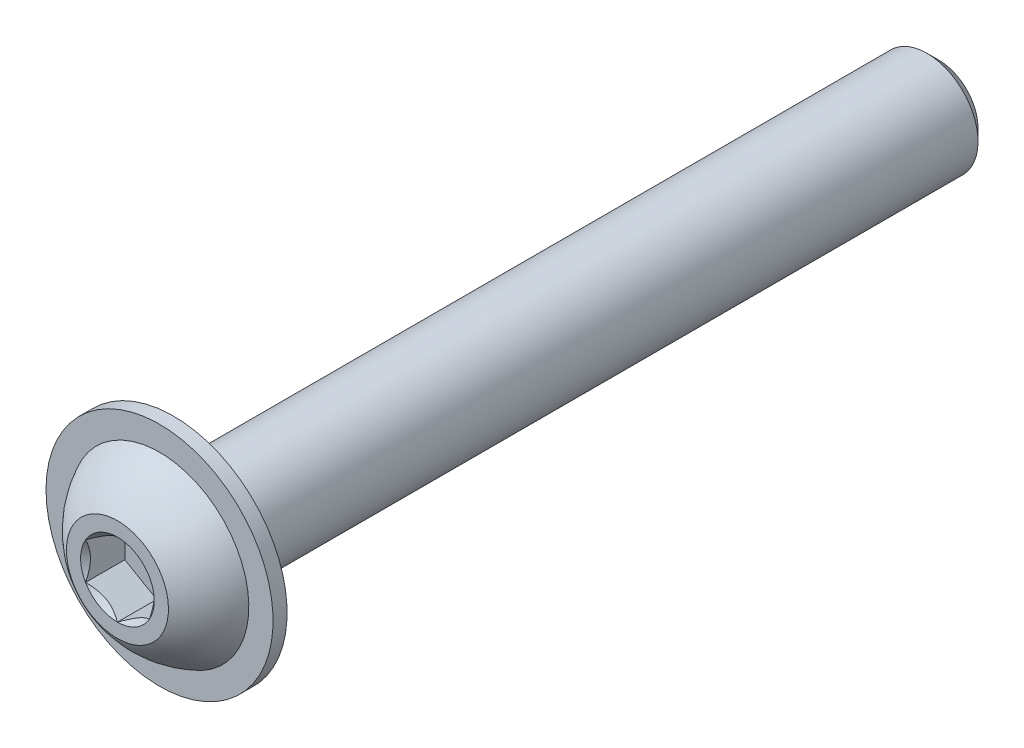
from build123d import *

# Parameters (mm, degrees)
SKETCH1_W           = 60
SKETCH1_H           = 4
CHAMFER1_SIZE       = 0.9375
SKETCH11_R          = 8.9
BOSS_EXTRUDE3_DEPTH = 1.1
CUT_EXTRUDE2_DEPTH  = 3.08


with BuildPart() as part:
    # Sketch1 → Revolve1 (revolve)
    with BuildSketch(Plane(origin=(0, 0, 0), x_dir=(0, 0, -1), z_dir=(1, 0, 0))):
        with Locations((34.4, 2)):
            Rectangle(SKETCH1_W, SKETCH1_H)
    revolve(axis=Axis((0, 0, -64.4), (0, 0, 1)))

    # Chamfer1
    chamfer1_edges = [part.edges().sort_by_distance(p)[0] for p in [
        (0, -4, -64.4),
    ]]
    chamfer(chamfer1_edges, length=CHAMFER1_SIZE)

    # Sketch7 → Revolve2 (revolve)
    with BuildSketch(Plane(origin=(0, 0, 0), x_dir=(0, 0, -1), z_dir=(1, 0, 0)), mode=Mode.PRIVATE) as revolve2_sk:
        with BuildLine():
            Line((3.3, 7), (4.4, 7))
            Line((4.4, 7), (4.4, 0))
            Line((4.4, 0), (0, 0))
            Line((0, 0), (0, 4))
            ThreePointArc((0, 4), (1.429846746, 5.74216858), (3.3, 7))
        make_face()
    revolve(revolve2_sk.sketch.rotate(Axis((0, 0, 0), (0, 0, -1)), 180), axis=Axis((0, 0, 0), (0, 0, -1)))

    # Sketch11 → Boss-Extrude3 (add)
    with BuildSketch(Plane(origin=(0, 0, -4.4), x_dir=(-1, 0, 0), z_dir=(0, 0, -1))):
        Circle(SKETCH11_R)
    extrude(amount=-BOSS_EXTRUDE3_DEPTH)

    # Sketch5 → Cut-Extrude2 (cut)
    with BuildSketch(Plane.XY):
        Polygon((2.5, -1.443375673), (2.5, 1.443375673), (0, 2.886751346), (-2.5, 1.443375673), (-2.5, -1.443375673), (0, -2.886751346), align=None)
    extrude(amount=-CUT_EXTRUDE2_DEPTH, mode=Mode.SUBTRACT)

    # Cut-Extrude3 cone 1 section (through the dimple's axis) → Cut-Extrude3 (revolve, cut)
    with BuildSketch(Plane(origin=(0, 0, 0), x_dir=(0, -1, 0), z_dir=(1, 0, 0))):
        Polygon((0, 0), (2.886751346, 0), (0, 2.886751346), align=None)
    revolve(axis=Axis((0, 0, 0), (0, 0, -1)), mode=Mode.SUBTRACT)


with BuildPart() as body_2:
    # Split1: the piece on the far side of the plane
    add(part.part)
    split(bisect_by=Plane(origin=(0, 0, -4.4), x_dir=(-1, 0, 0), z_dir=(0, 0, -1)), keep=Keep.BOTTOM)


with BuildPart() as part_1:
    add(part.part)

    # Split1
    split(bisect_by=Plane(origin=(0, 0, -4.4), x_dir=(-1, 0, 0), z_dir=(0, 0, -1)), keep=Keep.TOP)


solid = Compound([body_2.part, part_1.part])
